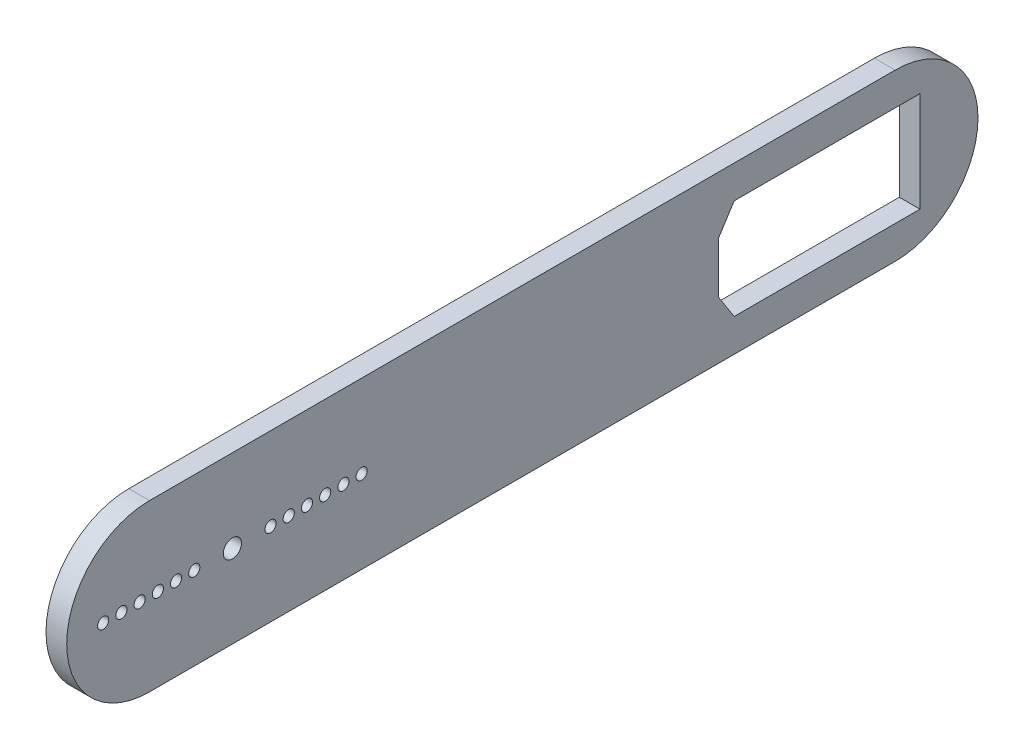
from build123d import *

# Parameters (mm, degrees)
SKETCH1_W               = 110
SKETCH1_H               = 20
BOSS_EXTRUDE1_DEPTH     = 1.25
CUT_EXTRUDE1_DEPTH      = 56.957573214
CUT_EXTRUDE1_DEPTH_BACK = 56.957573214
SKETCH2_R               = 1.1
CUT_EXTRUDE2_DEPTH      = 56.957573214
CUT_EXTRUDE2_DEPTH_BACK = 56.957573214
SKETCH3_R               = 0.675
CUT_EXTRUDE3_DEPTH      = 56.957573214
CUT_EXTRUDE3_DEPTH_BACK = 56.957573214
FILLET2_RADIUS          = 10
FILLET2_LENGTH          = 2.5
FILLET3_RADIUS          = 10
FILLET3_LENGTH          = 2.5


with BuildPart() as part:
    # Sketch1 → Boss-Extrude1 (new, symmetric)
    with BuildSketch(Plane(origin=(0, 0, 0), x_dir=(0, 0, -1), z_dir=(1, 0, 0))):
        Rectangle(SKETCH1_W, SKETCH1_H)
    extrude(amount=BOSS_EXTRUDE1_DEPTH, both=True)

    # Sketch2 → Cut-Extrude1 (cut, two sides: drawn at the far end of the back side and taken through both)
    with BuildSketch(Plane(origin=(1.25, 0, 0), x_dir=(0, 0, -1), z_dir=(1, 0, 0)).offset(-CUT_EXTRUDE1_DEPTH_BACK)):
        with Locations((-35, 0)):
            Circle(SKETCH2_R)
    extrude(amount=CUT_EXTRUDE1_DEPTH + CUT_EXTRUDE1_DEPTH_BACK, mode=Mode.SUBTRACT)

    # Sketch3 → Cut-Extrude2 (cut, two sides: drawn at the far end of the back side and taken through both)
    with BuildSketch(Plane(origin=(1.25, 0, 0), x_dir=(0, 0, -1), z_dir=(1, 0, 0)).offset(-CUT_EXTRUDE2_DEPTH_BACK)):
        with Locations((-50.6, 0)):
            Circle(SKETCH3_R)
        with Locations((-48.4, 0)):
            Circle(SKETCH3_R)
        with Locations((-46.2, 0)):
            Circle(SKETCH3_R)
        with Locations((-44, 0)):
            Circle(SKETCH3_R)
        with Locations((-41.8, 0)):
            Circle(SKETCH3_R)
        with Locations((-39.6, 0)):
            Circle(SKETCH3_R)
        with Locations((-30.4, 0)):
            Circle(SKETCH3_R)
        with Locations((-28.2, 0)):
            Circle(SKETCH3_R)
        with Locations((-26, 0)):
            Circle(SKETCH3_R)
        with Locations((-23.8, 0)):
            Circle(SKETCH3_R)
        with Locations((-21.6, 0)):
            Circle(SKETCH3_R)
        with Locations((-19.4, 0)):
            Circle(SKETCH3_R)
    extrude(amount=CUT_EXTRUDE2_DEPTH + CUT_EXTRUDE2_DEPTH_BACK, mode=Mode.SUBTRACT)

    # Sketch4 → Cut-Extrude3 (cut, two sides: drawn at the far end of the back side and taken through both)
    with BuildSketch(Plane(origin=(1.25, 0, 0), x_dir=(0, 0, -1), z_dir=(1, 0, 0)).offset(-CUT_EXTRUDE3_DEPTH_BACK)):
        Polygon((25.569688234, -6.041537935), (48, -6.041537935), (48, 6.041537935), (25.569688234, 6.041537935), (23.701172911, 3.12608256), (23.701172911, -3.12608256), align=None)
    extrude(amount=CUT_EXTRUDE3_DEPTH + CUT_EXTRUDE3_DEPTH_BACK, mode=Mode.SUBTRACT)

    # Fillet2: full round fillet: the end face becomes a half cylinder, R = half its width
    fillet2_face = Plane((0, 0, -55), x_dir=(-1, 0, 0), z_dir=(0, 0, -1))  # on the end face: x along it, z out of the body
    fillet2_slab = fillet2_face.offset(-FILLET2_RADIUS / 2) * Box(FILLET2_LENGTH, 2 * FILLET2_RADIUS, FILLET2_RADIUS, mode=Mode.PRIVATE)  # the body's end, R deep
    fillet2_round = Plane((0, 0, -45), x_dir=(0, 0, -1), z_dir=(-1, 0, 0)) * Cylinder(FILLET2_RADIUS, FILLET2_LENGTH, mode=Mode.PRIVATE)  # its axis R under the face
    add(fillet2_slab - fillet2_round, mode=Mode.SUBTRACT)

    # Fillet3: full round fillet: the end face becomes a half cylinder, R = half its width
    fillet3_face = Plane((0, 0, 55), x_dir=(1, 0, 0), z_dir=(0, 0, 1))  # on the end face: x along it, z out of the body
    fillet3_slab = fillet3_face.offset(-FILLET3_RADIUS / 2) * Box(FILLET3_LENGTH, 2 * FILLET3_RADIUS, FILLET3_RADIUS, mode=Mode.PRIVATE)  # the body's end, R deep
    fillet3_round = Plane((0, 0, 45), x_dir=(0, 0, 1), z_dir=(1, 0, 0)) * Cylinder(FILLET3_RADIUS, FILLET3_LENGTH, mode=Mode.PRIVATE)  # its axis R under the face
    add(fillet3_slab - fillet3_round, mode=Mode.SUBTRACT)


solid = part.part
